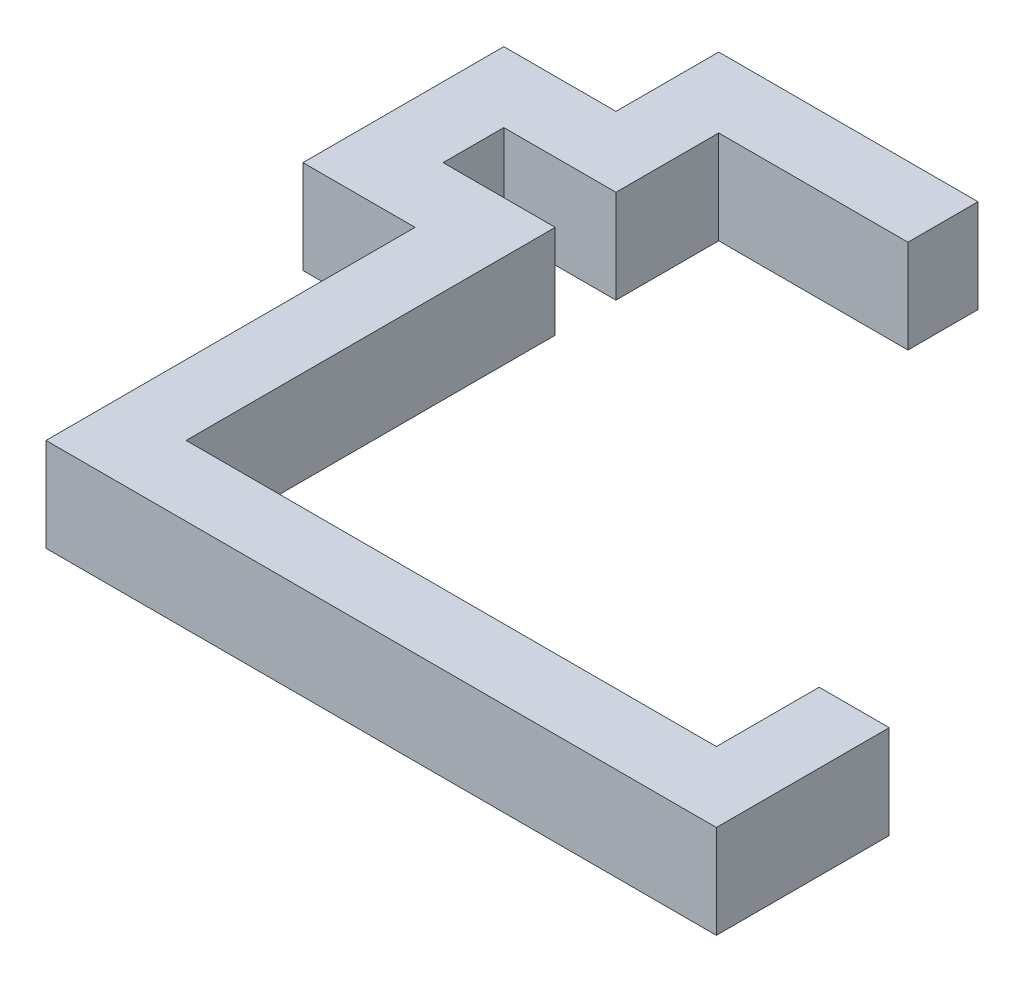
from build123d import *

# Parameters (mm, degrees)
BOSS_EXTRUDE1_DEPTH = 4


with BuildPart() as part:
    # Sketch1 → Boss-Extrude1 (new body)
    with BuildSketch(Plane(origin=(0, 0, 0), x_dir=(1, 0, 0), z_dir=(0, 1, 0))):
        Polygon((0, 0), (-22.7, 0), (-22.7, 15.8), (-27.5, 15.8), (-27.5, 18.4), (-22.7, 18.4), (-22.7, 22.8), (-14.6, 22.8), (-14.6, 25.8), (-25.7, 25.8), (-25.7, 21.4), (-30.5, 21.4), (-30.5, 12.8), (-25.7, 12.8), (-25.7, -3), (3, -3), (3, 4.4), (0, 4.4), align=None)
    extrude(amount=BOSS_EXTRUDE1_DEPTH)


solid = part.part
